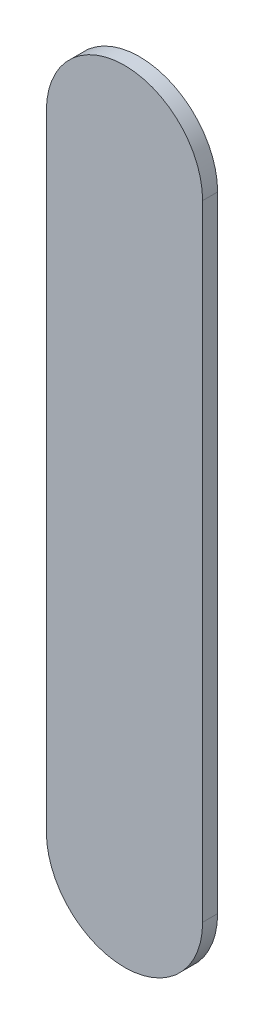
from build123d import *

# Parameters (mm, degrees)
BOSS_EXTRUDE1_DEPTH = 0.6096


with BuildPart() as part:
    # Sketch1 → Boss-Extrude1 (new body)
    with BuildSketch(Plane.XY):
        with BuildLine():
            Line((3.175, 12.7), (3.175, -12.7))
            ThreePointArc((3.175, -12.7), (0, -15.875), (-3.175, -12.7))
            Line((-3.175, -12.7), (-3.175, 12.7))
            ThreePointArc((-3.175, 12.7), (0, 15.875), (3.175, 12.7))
        make_face()
    extrude(amount=BOSS_EXTRUDE1_DEPTH)


solid = part.part
